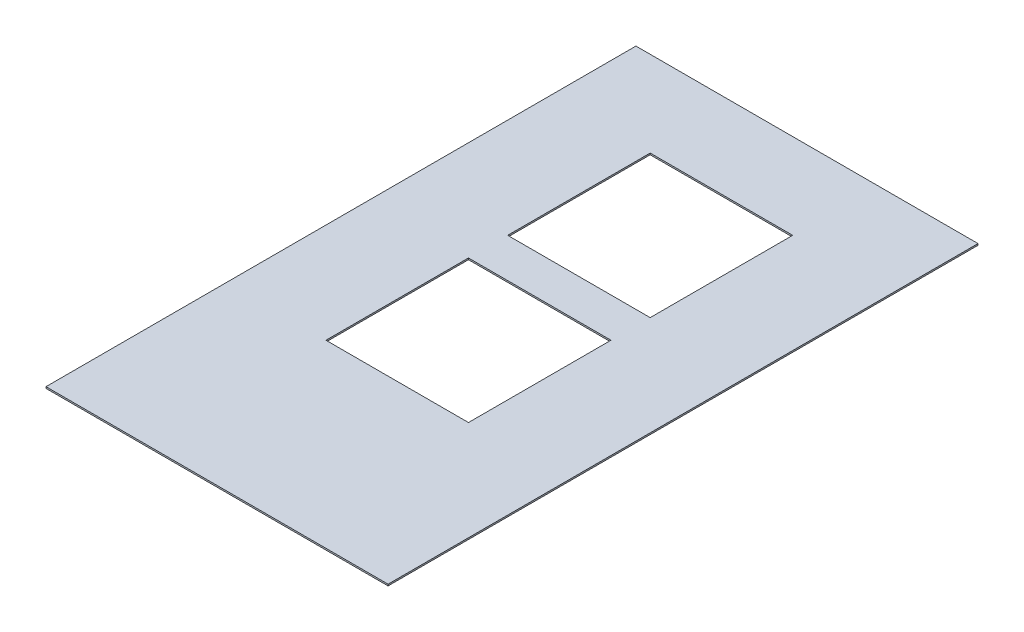
from build123d import *

# Parameters (mm, degrees)
SKETCH1_W               = 1219.2
SKETCH1_H               = 2102.64375
BOSS_EXTRUDE1_DEPTH     = 5.55625
CUT_EXTRUDE1_DEPTH      = 1216.286269472
CUT_EXTRUDE1_DEPTH_BACK = 1216.286269472
SKETCH2_W               = 508
SKETCH2_H               = 508


with BuildPart() as part:
    # Sketch1 → Boss-Extrude1 (new body)
    with BuildSketch(Plane(origin=(0, 0, 0), x_dir=(1, 0, 0), z_dir=(0, 1, 0))):
        Rectangle(SKETCH1_W, SKETCH1_H)
    extrude(amount=BOSS_EXTRUDE1_DEPTH)

    # Sketch2 → Cut-Extrude1 (cut, two sides: drawn at the far end of the back side and taken through both)
    with BuildSketch(Plane(origin=(0, 0, 0), x_dir=(-1, 0, 0), z_dir=(0, -1, 0)).offset(-CUT_EXTRUDE1_DEPTH_BACK)):
        with Locations((0, 492.521875)):
            Rectangle(SKETCH2_W, SKETCH2_H)
        with Locations((0, -155.178125)):
            Rectangle(SKETCH2_W, SKETCH2_H)
    extrude(amount=CUT_EXTRUDE1_DEPTH + CUT_EXTRUDE1_DEPTH_BACK, mode=Mode.SUBTRACT)


solid = part.part
